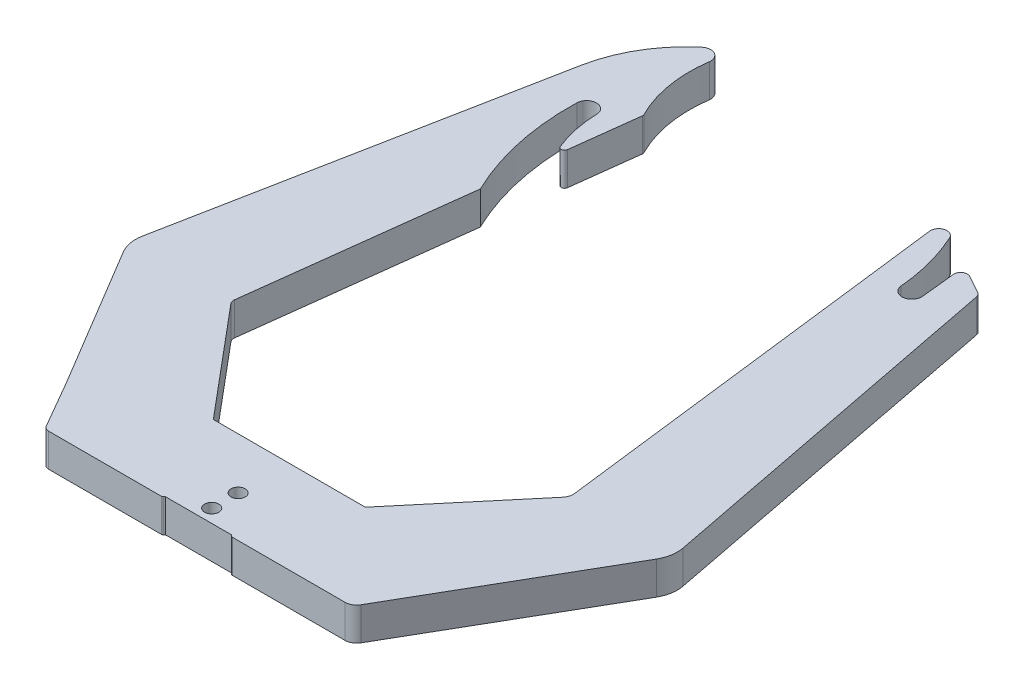
from build123d import *

# Parameters (mm, degrees)
EXTRUDE_1_DEPTH     = 10
CUT_EXTRUDE_1_REACH = 193.071
SKETCH_2_R          = 2.15
FILLET_1_R          = 1


with BuildPart() as part:
    # 草图1 → 凸台-拉伸1 (new body)
    with BuildSketch(Plane(origin=(0, 0, 0), x_dir=(1, 0, 0), z_dir=(0, 1, 0))):
        with BuildLine():
            Line((-23, 0), (23, 0))
            Line((23, 0), (50.285797586, 32.5179473))
            ThreePointArc((50.285797586, 32.5179473), (50.973364459, 33.797571478), (51.093655637, 35.245230373))
            Line((51.093655637, 35.245230373), (36.048986901, 157.774224452))
            ThreePointArc((36.048986901, 157.774224452), (37.845835898, 160.483359772), (40.800128771, 159.126807481))
            ThreePointArc((40.800128771, 159.126807481), (44.320748104, 149.357169855), (46.104078009, 139.126807481))
            ThreePointArc((46.104078009, 139.126807481), (49.378558351, 136.397919911), (52.076572947, 139.697884476))
            Line((52.076572947, 139.697884476), (50.986595809, 150.068324212))
            ThreePointArc((50.986595809, 150.068324212), (51.871765629, 151.945152782), (53.94525884, 152.026620552))
            Line((53.94525884, 152.026620552), (59.390134233, 149.008476838))
            ThreePointArc((59.390134233, 149.008476838), (60.038548982, 148.434807928), (60.38376936, 147.640855414))
            Line((60.38376936, 147.640855414), (81.817064827, 37.376109146))
            ThreePointArc((81.817064827, 37.376109146), (81.863649007, 33.817543133), (80.66104703, 30.468019192))
            Line((80.66104703, 30.468019192), (47.934130885, -26.216662346))
            ThreePointArc((47.934130885, -26.216662346), (46.628637115, -27.522156116), (44.845299462, -28))
            Line((44.845299462, -28), (10.707106781, -28))
            ThreePointArc((10.707106781, -28), (10.515765065, -27.961939766), (10.353553391, -27.853553391))
            Line((10.353553391, -27.853553391), (10, -27.5))
            Line((10, -27.5), (-10, -27.5))
            Line((-10, -27.5), (-10.353553391, -27.853553391))
            ThreePointArc((-10.353553391, -27.853553391), (-10.515765065, -27.961939766), (-10.707106781, -28))
            Line((-10.707106781, -28), (-44.845299462, -28))
            ThreePointArc((-44.845299462, -28), (-45.845299462, -27.732050808), (-46.577350269, -27))
            Line((-46.577350269, -27), (-54.72793721, -12.882769307))
            Line((-54.72793721, -12.882769307), (-80.66104703, 30.468019192))
            ThreePointArc((-80.66104703, 30.468019192), (-81.863649007, 33.817543133), (-81.817064827, 37.376109146))
            Line((-81.817064827, 37.376109146), (-60.205817968, 148.556335961))
            ThreePointArc((-60.205817968, 148.556335961), (-55.396009288, 161.24228741), (-46.622387315, 171.590774314))
            ThreePointArc((-46.622387315, 171.590774314), (-43.239620762, 171.913395421), (-41.72575767, 168.871124481))
            ThreePointArc((-41.72575767, 168.871124481), (-41.549863048, 156.552194932), (-37.633288365, 144.871124481))
            Line((-37.633288365, 144.871124481), (-51.176674229, 34.569098196))
            ThreePointArc((-51.176674229, 34.569098196), (-51.109221395, 33.75732882), (-50.723670812, 33.03978429))
            Line((-50.723670812, 33.03978429), (-23, 0))
        make_face()
    extrude(amount=EXTRUDE_1_DEPTH)

    # 草图2 → 切除-拉伸1 (cut, up to next)
    with BuildSketch(Plane(origin=(0, 10, 0), x_dir=(1, 0, 0), z_dir=(0, 1, 0)), mode=Mode.PRIVATE) as cut_extrude_1_sk1:
        with Locations(Location((0, -23.5, 0), (0, 0, 270))):
            Circle(SKETCH_2_R)
    cut_extrude_1_tool1 = extrude(cut_extrude_1_sk1.sketch, amount=-CUT_EXTRUDE_1_REACH, mode=Mode.PRIVATE) & part.part
    # 草图2 → 切除-拉伸1 (cut, up to next)
    with BuildSketch(Plane(origin=(0, 10, 0), x_dir=(1, 0, 0), z_dir=(0, 1, 0)), mode=Mode.PRIVATE) as cut_extrude_1_sk2:
        with Locations(Location((0, -15.5, 0), (0, 0, 270))):
            Circle(SKETCH_2_R)
    cut_extrude_1_tool2 = extrude(cut_extrude_1_sk2.sketch, amount=-CUT_EXTRUDE_1_REACH, mode=Mode.PRIVATE) & part.part
    # 草图2 → 切除-拉伸1 (cut, up to next)
    with BuildSketch(Plane(origin=(0, 10, 0), x_dir=(1, 0, 0), z_dir=(0, 1, 0)), mode=Mode.PRIVATE) as cut_extrude_1_sk3:
        with BuildLine():
            Line((-40.580117827, 120.871124481), (-43.035809045, 100.871124481))
            ThreePointArc((-43.035809045, 100.871124481), (-49.262696908, 118.999215044), (-50.998704156, 138.08816679))
            ThreePointArc((-50.998704156, 138.08816679), (-47.997070546, 140.99999857), (-45.001129375, 138.082310248))
            ThreePointArc((-45.001129375, 138.082310248), (-43.758467402, 129.228108775), (-40.580117827, 120.871124481))
        make_face()
    cut_extrude_1_tool3 = extrude(cut_extrude_1_sk3.sketch, amount=-CUT_EXTRUDE_1_REACH, mode=Mode.PRIVATE) & part.part
    add(cut_extrude_1_tool1.solids().sort_by_distance((0, 10, 23.5))[0], mode=Mode.SUBTRACT)
    add(cut_extrude_1_tool2.solids().sort_by_distance((0, 10, 15.5))[0], mode=Mode.SUBTRACT)
    add(cut_extrude_1_tool3.solids().sort_by_distance((-46.028937, 10, -123.122257))[0], mode=Mode.SUBTRACT)

    # 圆角1
    fillet_1_edges = [part.edges().sort_by_distance(p)[0] for p in [
        (-40.580117827, 5, -120.871124481),
        (-37.633288365, 5, -144.871124481),
    ]]
    fillet(fillet_1_edges, radius=FILLET_1_R)


solid = part.part
